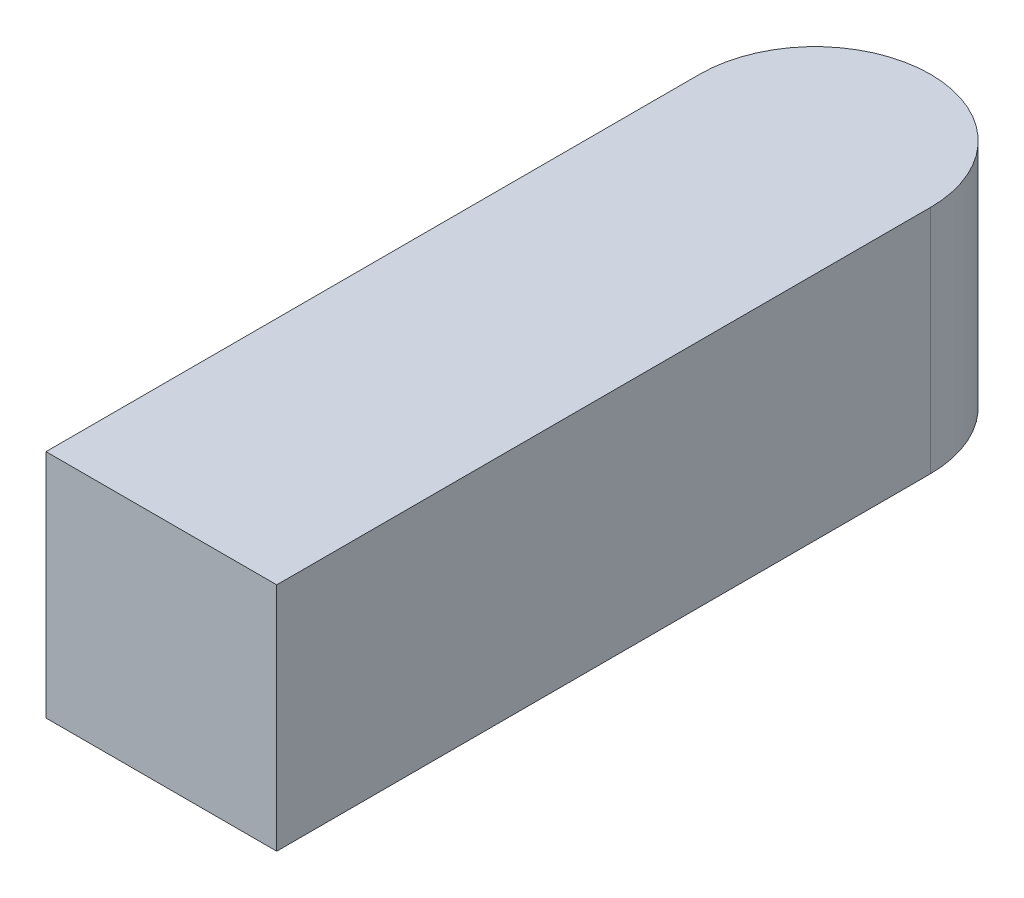
from build123d import *

# Parameters (mm, degrees)
BOSS_EXTRUDE1_DEPTH = 1.5


with BuildPart() as part:
    # Sketch2 → Boss-Extrude1 (new, symmetric)
    with BuildSketch(Plane(origin=(0, 0, 0), x_dir=(1, 0, 0), z_dir=(0, 1, 0))):
        with BuildLine():
            Line((-1.5, 4.25), (-1.5, -4.25))
            Line((-1.5, -4.25), (1.5, -4.25))
            Line((1.5, -4.25), (1.5, 4.25))
            ThreePointArc((1.5, 4.25), (0, 5.75), (-1.5, 4.25))
        make_face()
    extrude(amount=BOSS_EXTRUDE1_DEPTH, both=True)


solid = part.part
